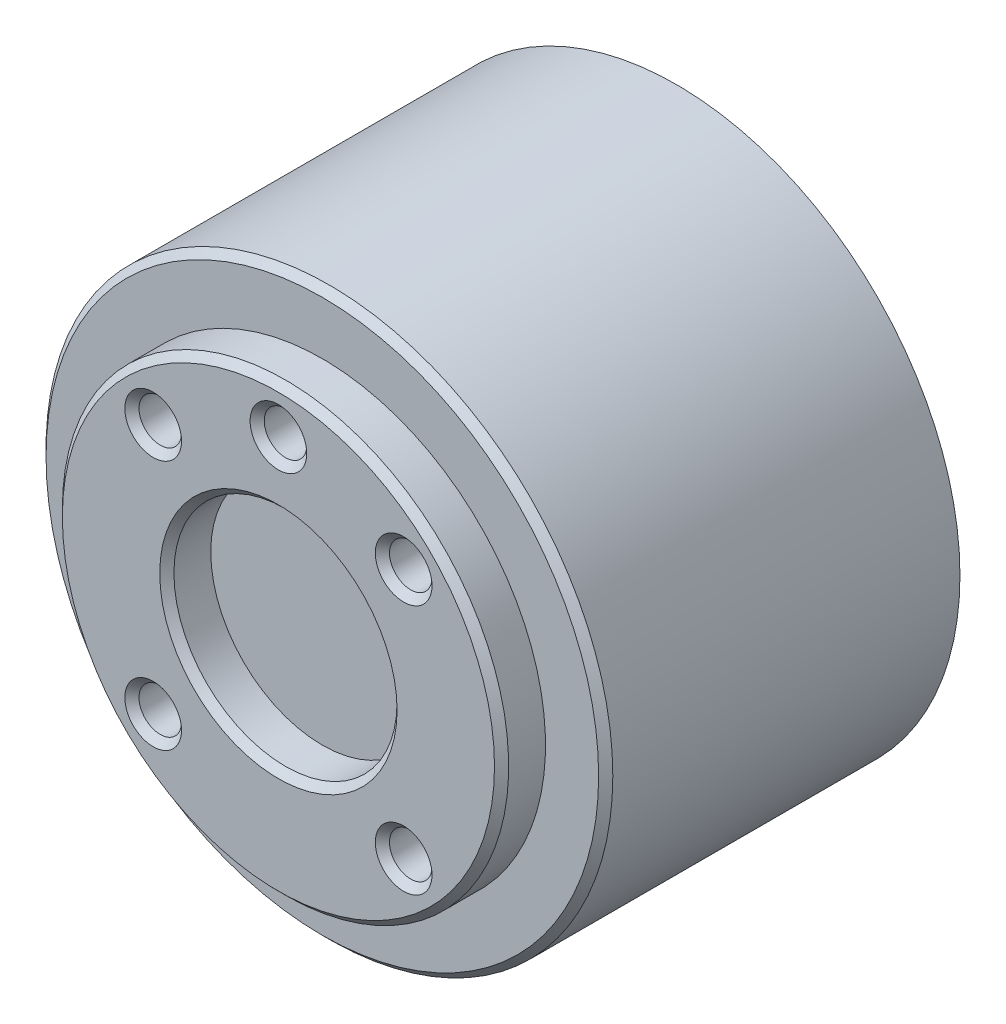
from build123d import *

# Parameters (mm, degrees)
SKIZZE1_R                       = 40
AUFSATZ_LINEAR_AUSTRAGEN1_DEPTH = 50
SKIZZE2_R                       = 31.5
SKIZZE2_R_2                     = 15.75
SKIZZE2_R_3                     = 3
AUFSATZ_LINEAR_AUSTRAGEN2_DEPTH = 6.2
FASE1_SIZE                      = 1


with BuildPart() as part:
    # Skizze1 → Aufsatz-Linear austragen1 (new body)
    with BuildSketch(Plane.XY):
        Circle(SKIZZE1_R)
    extrude(amount=AUFSATZ_LINEAR_AUSTRAGEN1_DEPTH)

    # Skizze2 → Aufsatz-Linear austragen2 (add)
    with BuildSketch(Plane.XY.offset(50)):
        with Locations(Location((0, 0, 0), (0, 0, 180))):
            Circle(SKIZZE2_R)
        with Locations(Location((0, 0, 0), (0, 0, 180))):
            Circle(SKIZZE2_R_2, mode=Mode.SUBTRACT)
        with Locations(Location((0, 25, 0), (0, 0, 180))):
            Circle(SKIZZE2_R_3, mode=Mode.SUBTRACT)
        with Locations(Location((17.67766953, 17.67766953, 0), (0, 0, 180))):
            Circle(SKIZZE2_R_3, mode=Mode.SUBTRACT)
        with Locations(Location((17.67766953, -17.67766953, 0), (0, 0, 180))):
            Circle(SKIZZE2_R_3, mode=Mode.SUBTRACT)
        with Locations(Location((-17.67766953, -17.67766953, 0), (0, 0, 180))):
            Circle(SKIZZE2_R_3, mode=Mode.SUBTRACT)
        with Locations(Location((-17.67766953, 17.67766953, 0), (0, 0, 180))):
            Circle(SKIZZE2_R_3, mode=Mode.SUBTRACT)
    extrude(amount=AUFSATZ_LINEAR_AUSTRAGEN2_DEPTH)

    # Fase1
    fase1_edges = [part.edges().sort_by_distance(p)[0] for p in [
        (31.5, 0, 56.2),
        (15.75, 0, 56.2),
        (3, 25, 56.2),
        (20.67766953, 17.67766953, 56.2),
        (20.67766953, -17.67766953, 56.2),
        (-14.67766953, -17.67766953, 56.2),
        (-14.67766953, 17.67766953, 56.2),
        (-40, 0, 50),
    ]]
    chamfer(fase1_edges, length=FASE1_SIZE)


solid = part.part
